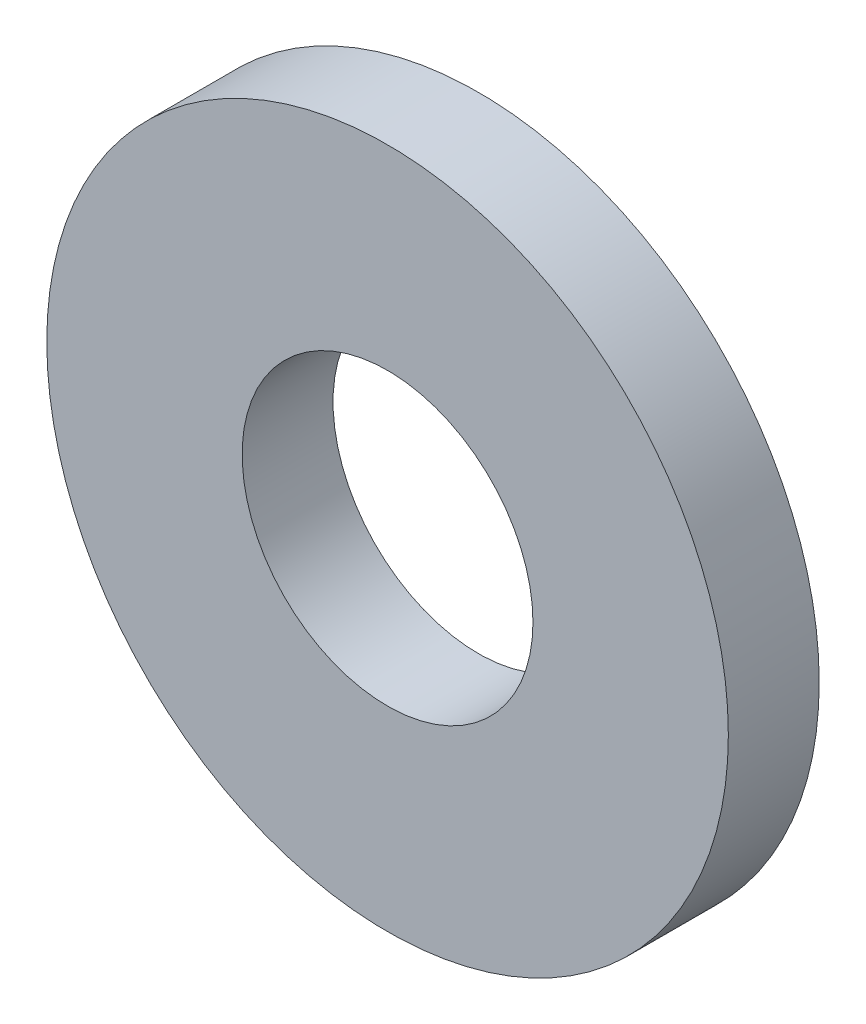
from build123d import *

# Parameters (mm, degrees)
SKETCH1_R           = 9.525
BOSS_EXTRUDE1_DEPTH = 2.54
SKETCH2_R           = 4.064
CUT_EXTRUDE1_DEPTH  = 14.707766047


with BuildPart() as part:
    # Sketch1 → Boss-Extrude1 (new body)
    with BuildSketch(Plane(origin=(0, 0, 0), x_dir=(0, 1, 0), z_dir=(0, 0, 1))):
        with Locations(Location((0, 0, 0), (0, 0, 270))):
            Circle(SKETCH1_R)
    extrude(amount=BOSS_EXTRUDE1_DEPTH)

    # Sketch2 → Cut-Extrude1 (cut, through all)
    with BuildSketch(Plane.XY.offset(2.54)):
        Circle(SKETCH2_R)
    extrude(amount=-CUT_EXTRUDE1_DEPTH, mode=Mode.SUBTRACT)


solid = part.part
